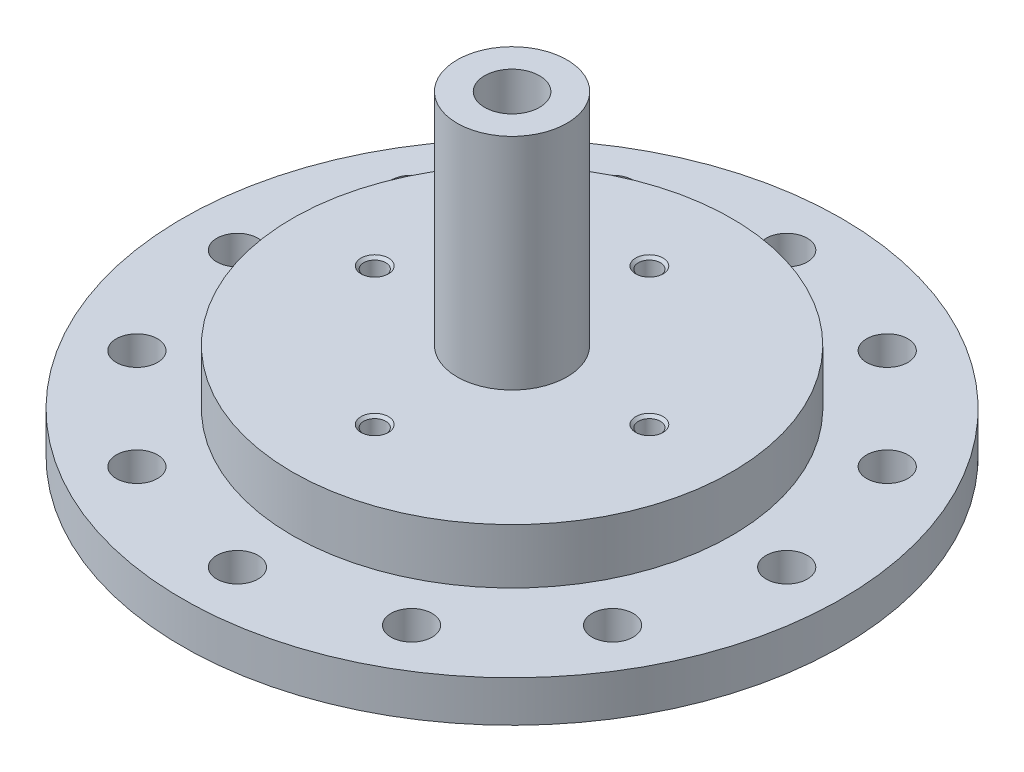
from build123d import *

# Parameters (mm, degrees)
SKETCH1_W                        = 76.2
SKETCH1_H                        = 9.525
SKETCH2_R                        = 50.8
BOSS_EXTRUDE1_DEPTH              = 12.7
SKETCH3_R                        = 12.7
BOSS_EXTRUDE2_DEPTH              = 50.8
F_3_8_0_375_DIAMETER_HOLE1_D     = 9.525
F_2_4_5_TAPPED_HOLE1_D           = 12.7
F_2_4_5_TAPPED_HOLE1_CBORE_D     = 50.8
F_2_4_5_TAPPED_HOLE1_CBORE_DEPTH = 3.175
F_7_0_201_DIAMETER_HOLE1_D       = 5.1054
F_7_0_201_DIAMETER_HOLE1_DEPTH   = 12.7
F_7_0_201_DIAMETER_HOLE1_TIP     = 1.533816902
CHAMFER1_SIZE                    = 0.622299999
CHAMFER1_SIZE2                   = 0.622300001


with BuildPart() as part:
    # Sketch1 → Revolve1 (revolve)
    with BuildSketch(Plane.XY, mode=Mode.PRIVATE) as revolve1_sk:
        with Locations((38.1, 4.7625)):
            Rectangle(SKETCH1_W, SKETCH1_H)
    revolve(revolve1_sk.sketch.rotate(Axis((0, 9.525, 0), (0, -1, 0)), 270), axis=Axis((0, 9.525, 0), (0, -1, 0)))

    # Sketch2 → Boss-Extrude1 (add)
    with BuildSketch(Plane(origin=(0, 9.525, 0), x_dir=(-1, 0, 0), z_dir=(0, 1, 0))):
        with Locations(Location((0, 0, 0), (0, 0, 90))):
            Circle(SKETCH2_R)
    extrude(amount=BOSS_EXTRUDE1_DEPTH)

    # Sketch3 → Boss-Extrude2 (add)
    with BuildSketch(Plane(origin=(0, 22.225, 0), x_dir=(-1, 0, 0), z_dir=(0, 1, 0))):
        with Locations(Location((0, 0, 0), (0, 0, 90))):
            Circle(SKETCH3_R)
    extrude(amount=BOSS_EXTRUDE2_DEPTH)

    # 3/8 (0.375) Diameter Hole1 (through all)
    with Locations(Plane(origin=(0, 9.525, 0), x_dir=(1, 0, 0), z_dir=(0, 1, 0))):
        with Locations((63.5, 0), (54.99261314, 31.75), (31.75, 54.99261314), (0, -63.5), (-31.75, -54.99261314), (-54.99261314, -31.75), (-63.5, 0), (-54.99261314, 31.75), (-31.75, 54.99261314), (0, 63.5), (31.75, -54.99261314), (54.99261314, -31.75)):
            Hole(F_3_8_0_375_DIAMETER_HOLE1_D / 2)

    # 2-4.5 Tapped Hole1 (through all)
    with Locations(Plane(origin=(0, 0, 0), x_dir=(-1, 0, 0), z_dir=(0, -1, 0))):
        with Locations((0, 0)):
            CounterBoreHole(F_2_4_5_TAPPED_HOLE1_D / 2, F_2_4_5_TAPPED_HOLE1_CBORE_D / 2, F_2_4_5_TAPPED_HOLE1_CBORE_DEPTH)

    # #7 (0.201) Diameter Hole1
    with Locations(Plane(origin=(0, 22.225, 0), x_dir=(1, 0, 0), z_dir=(0, 1, 0))):
        with Locations((31.75, 0), (0, -31.75), (0, 31.75), (-31.75, 0)):
            Hole(F_7_0_201_DIAMETER_HOLE1_D / 2, depth=F_7_0_201_DIAMETER_HOLE1_DEPTH)
            with Locations((0, 0, -(F_7_0_201_DIAMETER_HOLE1_DEPTH + F_7_0_201_DIAMETER_HOLE1_TIP / 2))):  # 118° drill point
                Cone(0, F_7_0_201_DIAMETER_HOLE1_D / 2, F_7_0_201_DIAMETER_HOLE1_TIP, mode=Mode.SUBTRACT)

    # Chamfer1
    chamfer1_edges = [part.edges().sort_by_distance(p)[0] for p in [
        (-29.1973, 22.225, 0),
        (2.5527, 22.225, -31.75),
        (2.5527, 22.225, 31.75),
        (34.3027, 22.225, 0),
    ]]
    chamfer1_side = [part.faces().sort_by_distance(p)[0] for p in [
        (0, 22.225, -49.363159021),
    ]]
    chamfer(chamfer1_edges, length=CHAMFER1_SIZE, length2=CHAMFER1_SIZE2, reference=chamfer1_side[0])


solid = part.part
